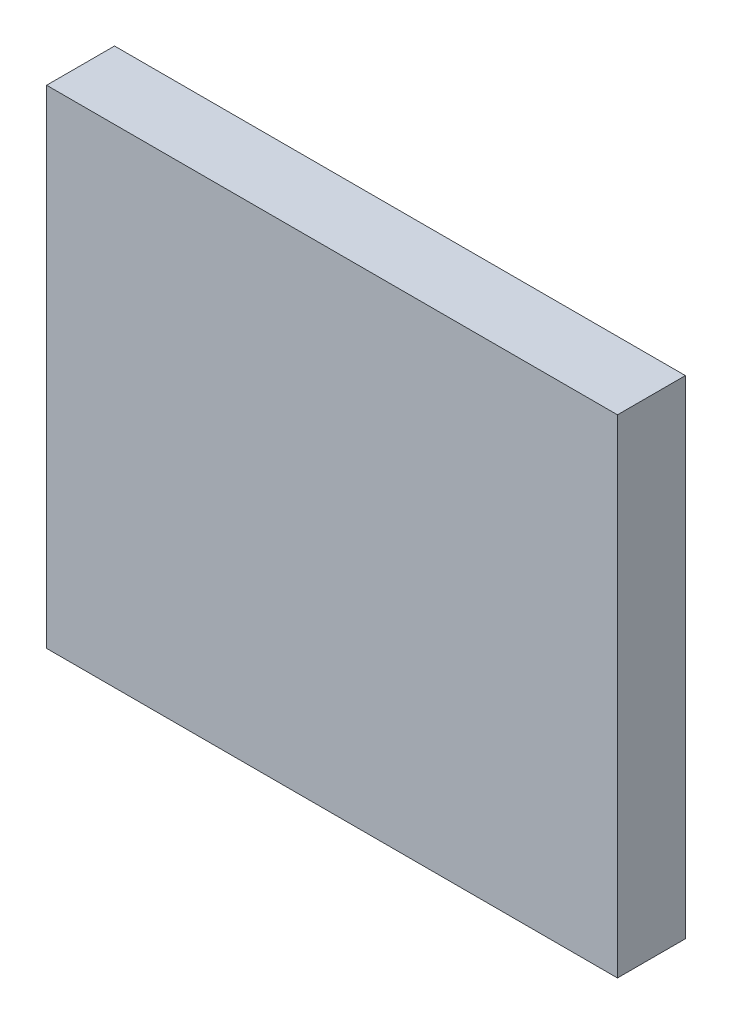
from build123d import *

# Parameters (mm, degrees)
SKETCH1_W           = 84.038871321
SKETCH1_H           = 71.803326837
BOSS_EXTRUDE3_DEPTH = 10


with BuildPart() as part:
    # Sketch1 → Boss-Extrude3 (new body)
    with BuildSketch(Plane.XY):
        with Locations((-12.335152734, -7.62989568)):
            Rectangle(SKETCH1_W, SKETCH1_H)
    extrude(amount=BOSS_EXTRUDE3_DEPTH)


solid = part.part
